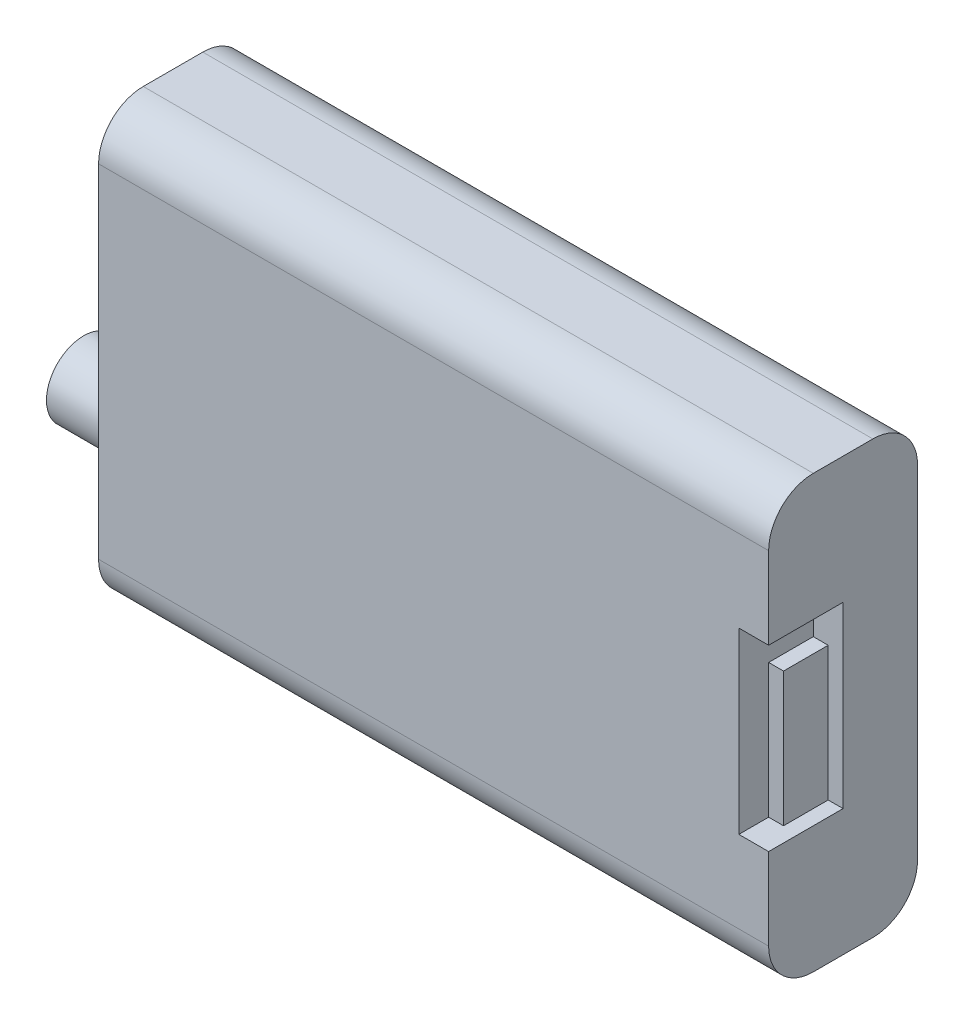
from build123d import *

# Parameters (mm, degrees)
SKETCH1_W           = 45
SKETCH1_H           = 29
BOSS_EXTRUDE1_DEPTH = 10
SKETCH2_W           = 2
SKETCH2_H           = 12
CUT_EXTRUDE1_DEPTH  = 5
SKETCH3_W           = 3
SKETCH3_H           = 9
BOSS_EXTRUDE2_DEPTH = 1
SKETCH4_R           = 2.5
BOSS_EXTRUDE3_DEPTH = 6
SKETCH5_R           = 1.85
CUT_EXTRUDE2_DEPTH  = 4
SKETCH6_R           = 0.275
BOSS_EXTRUDE4_DEPTH = 4
FILLET2_R           = 3
FILLET3_R           = 3
FILLET4_R           = 3
FILLET5_R           = 3


with BuildPart() as part:
    # Sketch1 → Boss-Extrude1 (new body)
    with BuildSketch(Plane.XY):
        Rectangle(SKETCH1_W, SKETCH1_H)
    extrude(amount=BOSS_EXTRUDE1_DEPTH)

    # Sketch2 → Cut-Extrude1 (cut)
    with BuildSketch(Plane.XY.offset(10)):
        with Locations((21.5, 0)):
            Rectangle(SKETCH2_W, SKETCH2_H)
    extrude(amount=-CUT_EXTRUDE1_DEPTH, mode=Mode.SUBTRACT)

    # Sketch3 → Boss-Extrude2 (add)
    with BuildSketch(Plane(origin=(20.5, 0, 0), x_dir=(0, 0, -1), z_dir=(1, 0, 0))):
        with Locations((-6.5, -1.5)):
            Rectangle(SKETCH3_W, SKETCH3_H)
    extrude(amount=BOSS_EXTRUDE2_DEPTH)

    # Sketch4 → Boss-Extrude3 (add)
    with BuildSketch(Plane.ZY.offset(22.5)):
        with Locations(Location((5, -6.5, 0), (0, 0, 180))):
            Circle(SKETCH4_R)
    extrude(amount=BOSS_EXTRUDE3_DEPTH)

    # Sketch5 → Cut-Extrude2 (cut)
    with BuildSketch(Plane.ZY.offset(28.5)):
        with Locations((5, -6.5)):
            Circle(SKETCH5_R)
    extrude(amount=-CUT_EXTRUDE2_DEPTH, mode=Mode.SUBTRACT)

    # Sketch6 → Boss-Extrude4 (add)
    with BuildSketch(Plane.ZY.offset(24.5)):
        with Locations((5, -6.5)):
            Circle(SKETCH6_R)
    extrude(amount=BOSS_EXTRUDE4_DEPTH)

    # Fillet2
    fillet2_edges = [part.edges().sort_by_distance(p)[0] for p in [
        (0, 14.5, 0),
    ]]
    fillet(fillet2_edges, radius=FILLET2_R)

    # Fillet3
    fillet3_edges = [part.edges().sort_by_distance(p)[0] for p in [
        (0, 14.5, 10),
    ]]
    fillet(fillet3_edges, radius=FILLET3_R)

    # Fillet4
    fillet4_edges = [part.edges().sort_by_distance(p)[0] for p in [
        (0, -14.5, 0),
    ]]
    fillet(fillet4_edges, radius=FILLET4_R)

    # Fillet5
    fillet5_edges = [part.edges().sort_by_distance(p)[0] for p in [
        (0, -14.5, 10),
    ]]
    fillet(fillet5_edges, radius=FILLET5_R)


solid = part.part
